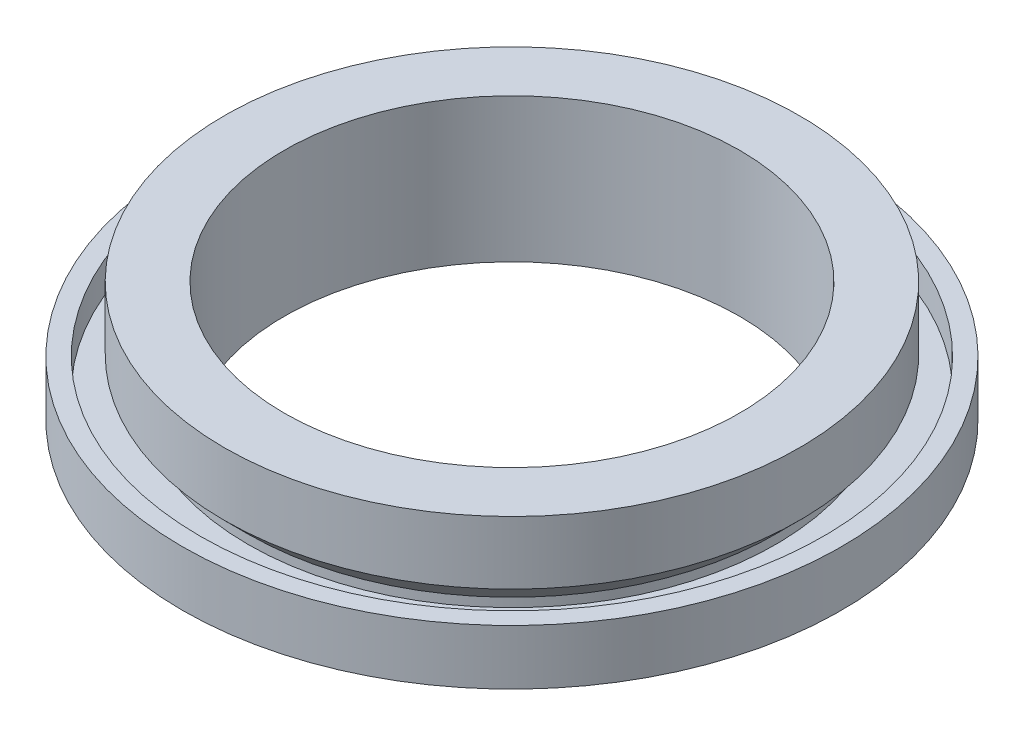
from build123d import *

# Parameters (mm, degrees)
FILLET1_R = 1


with BuildPart() as part:
    # Sketch2 → Revolve1 (revolve)
    with BuildSketch(Plane.XY, mode=Mode.PRIVATE) as revolve1_sk:
        Polygon((-22, 4), (-22, 4.75), (-24, 6.75), (-24, 12), (-19, 12), (-19, 0), (-23.75, 0), (-23.75, 2), (-27.5, 2), (-27.5, 6.6), (-26, 6.6), (-26, 4), align=None)
    revolve(revolve1_sk.sketch.rotate(Axis((0, 74.572866062, 0), (0, -1, 0)), 270), axis=Axis((0, 74.572866062, 0), (0, -1, 0)))

    # Fillet1
    fillet1_edges = [part.edges().sort_by_distance(p)[0] for p in [
        (0, 2, -23.75),
    ]]
    fillet(fillet1_edges, radius=FILLET1_R)


solid = part.part
